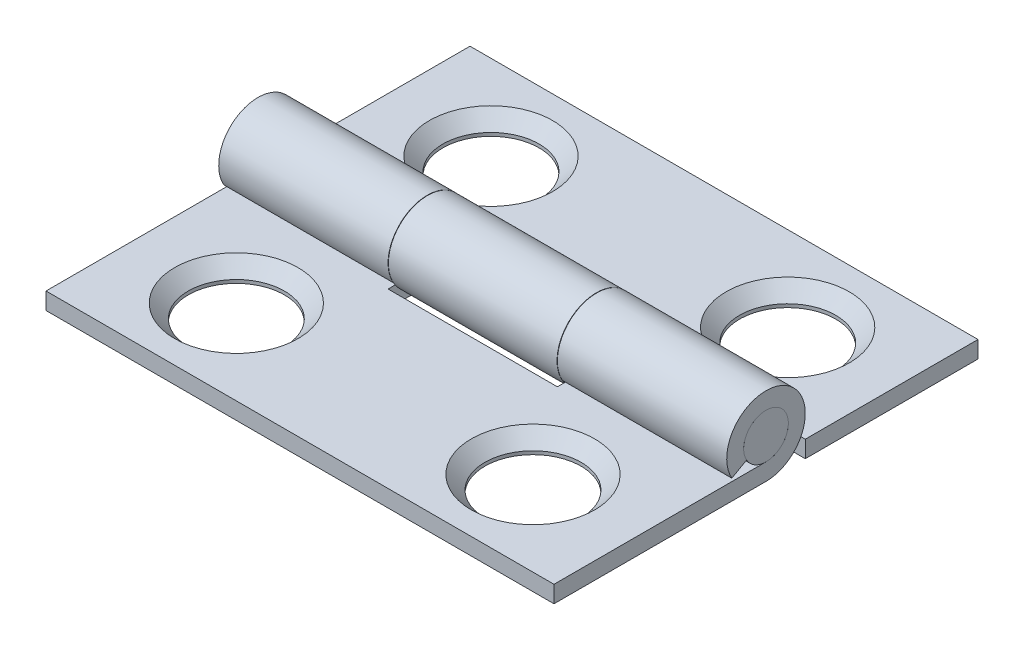
from build123d import *

# Parameters (mm, degrees)
BOSS_EXTRUDE1_DEPTH     = 9.525
CIRPATTERN1_COUNT       = 2
CUT_EXTRUDE1_DEPTH      = 13.494063522
CUT_EXTRUDE1_DEPTH_BACK = 13.494063522
SKETCH4_W               = 6.35
SKETCH4_H               = 2.9464
CUT_EXTRUDE4_DEPTH      = 13.494063522
CUT_EXTRUDE4_DEPTH_BACK = 13.494063522
SKETCH10_W              = 6.3627
SKETCH10_H              = 2.9464
CUT_EXTRUDE3_DEPTH      = 13.494063522
CUT_EXTRUDE3_DEPTH_BACK = 13.494063522
SKETCH9_R               = 1.8034
CUT_EXTRUDE6_DEPTH      = 13.620375391
CUT_EXTRUDE6_DEPTH_BACK = 13.620375391
SKETCH12_R              = 1.8034
SKETCH6_R               = 0.8382
BOSS_EXTRUDE2_DEPTH     = 9.525


with BuildPart() as part:
    # Sketch3 → Boss-Extrude1 (new, symmetric)
    with BuildSketch(Plane(origin=(0, 0, 0), x_dir=(0, 0, -1), z_dir=(1, 0, 0))):
        with BuildLine():
            Line((0, -1.4732), (-7.9502, -1.4732))
            Line((-7.9502, -1.4732), (-7.9502, -0.8382))
            Line((-7.9502, -0.8382), (0, -0.8382))
            ThreePointArc((0, -0.8382), (0.421388638, 0.724576328), (-0.728533124, -0.414510226))
            Line((-0.728533124, -0.414510226), (-1.280452157, -0.728533124))
            ThreePointArc((-1.280452157, -0.728533124), (0.740622455, 1.273497789), (0, -1.4732))
        make_face()
    extrude(amount=BOSS_EXTRUDE1_DEPTH, both=True)


with BuildPart() as cirpattern1_1:
    # CirPattern1: pattern copy
    add(part.part.rotate(Axis((0, 0, 0), (0, 1, 0)), 1 * 360 / CIRPATTERN1_COUNT))

    # Sketch10 → Cut-Extrude4 (cut, two sides: drawn at the far end of the back side and taken through both)
    with BuildSketch(Plane(origin=(0, 0, 0), x_dir=(1, 0, 0), z_dir=(0, 1, 0)).offset(-CUT_EXTRUDE4_DEPTH_BACK)):
        with Locations((-6.34365, 0)):
            Rectangle(SKETCH10_W, SKETCH10_H)
        with Locations((6.34365, 0)):
            Rectangle(SKETCH10_W, SKETCH10_H)
    extrude(amount=CUT_EXTRUDE4_DEPTH + CUT_EXTRUDE4_DEPTH_BACK, mode=Mode.SUBTRACT)

    # Cut-Extrude5 cone 1 section (through the dimple's axis) → Cut-Extrude5 (revolve, cut)
    with BuildSketch(Plane(origin=(5.5626, -0.8382, -4.7752), x_dir=(0, 0, 1), z_dir=(1, 0, 0))):
        Polygon((0, 0), (2.3114, 0), (0, 2.3114), align=None)
    revolve(axis=Axis((5.5626, -0.8382, -4.7752), (0, -1, 0)), mode=Mode.SUBTRACT)

    # Cut-Extrude5 cone 2 section (through the dimple's axis) → Cut-Extrude5 cone 2 (revolve, cut)
    with BuildSketch(Plane(origin=(-5.5626, -0.8382, -4.7752), x_dir=(0, 0, 1), z_dir=(1, 0, 0))):
        Polygon((0, 0), (2.3114, 0), (0, 2.3114), align=None)
    revolve(axis=Axis((-5.5626, -0.8382, -4.7752), (0, -1, 0)), mode=Mode.SUBTRACT)

    # Sketch12 → Cut-Extrude6 (cut, two sides: drawn at the far end of the back side and taken through both)
    with BuildSketch(Plane(origin=(0, -0.8382, 0), x_dir=(1, 0, 0), z_dir=(0, 1, 0)).offset(-CUT_EXTRUDE6_DEPTH_BACK)):
        with Locations(Location((-5.5626, 4.7752, 0), (0, 0, 270))):
            Circle(SKETCH12_R)
        with Locations(Location((5.5626, 4.7752, 0), (0, 0, 270))):
            Circle(SKETCH12_R)
    extrude(amount=CUT_EXTRUDE6_DEPTH + CUT_EXTRUDE6_DEPTH_BACK, mode=Mode.SUBTRACT)


with BuildPart() as part_1:
    add(part.part)

    # Sketch4 → Cut-Extrude1 (cut, two sides: drawn at the far end of the back side and taken through both)
    with BuildSketch(Plane(origin=(0, 0, 0), x_dir=(1, 0, 0), z_dir=(0, 1, 0)).offset(-CUT_EXTRUDE1_DEPTH_BACK)):
        Rectangle(SKETCH4_W, SKETCH4_H)
    extrude(amount=CUT_EXTRUDE1_DEPTH + CUT_EXTRUDE1_DEPTH_BACK, mode=Mode.SUBTRACT)

    # Cut-Extrude2 cone 1 section (through the dimple's axis) → Cut-Extrude2 (revolve, cut)
    with BuildSketch(Plane(origin=(5.5626, -0.8382, 4.7752), x_dir=(0, 0, 1), z_dir=(1, 0, 0))):
        Polygon((0, 0), (2.3114, 0), (0, 2.3114), align=None)
    revolve(axis=Axis((5.5626, -0.8382, 4.7752), (0, -1, 0)), mode=Mode.SUBTRACT)

    # Cut-Extrude2 cone 2 section (through the dimple's axis) → Cut-Extrude2 cone 2 (revolve, cut)
    with BuildSketch(Plane(origin=(-5.5626, -0.8382, 4.7752), x_dir=(0, 0, 1), z_dir=(1, 0, 0))):
        Polygon((0, 0), (2.3114, 0), (0, 2.3114), align=None)
    revolve(axis=Axis((-5.5626, -0.8382, 4.7752), (0, -1, 0)), mode=Mode.SUBTRACT)

    # Sketch9 → Cut-Extrude3 (cut, two sides: drawn at the far end of the back side and taken through both)
    with BuildSketch(Plane(origin=(0, 0, 0), x_dir=(1, 0, 0), z_dir=(0, 1, 0)).offset(-CUT_EXTRUDE3_DEPTH_BACK)):
        with Locations(Location((5.5626, -4.7752, 0), (0, 0, 270))):
            Circle(SKETCH9_R)
        with Locations(Location((-5.5626, -4.7752, 0), (0, 0, 270))):
            Circle(SKETCH9_R)
    extrude(amount=CUT_EXTRUDE3_DEPTH + CUT_EXTRUDE3_DEPTH_BACK, mode=Mode.SUBTRACT)


with BuildPart() as body_3:
    # Sketch6 → Boss-Extrude2 (new, symmetric)
    with BuildSketch(Plane(origin=(0, 0, 0), x_dir=(0, 0, -1), z_dir=(1, 0, 0))):
        with Locations(Location((0, 0, 0), (0, 0, 180))):
            Circle(SKETCH6_R)
    extrude(amount=BOSS_EXTRUDE2_DEPTH, both=True)


solid = Compound([cirpattern1_1.part, part_1.part, body_3.part])
